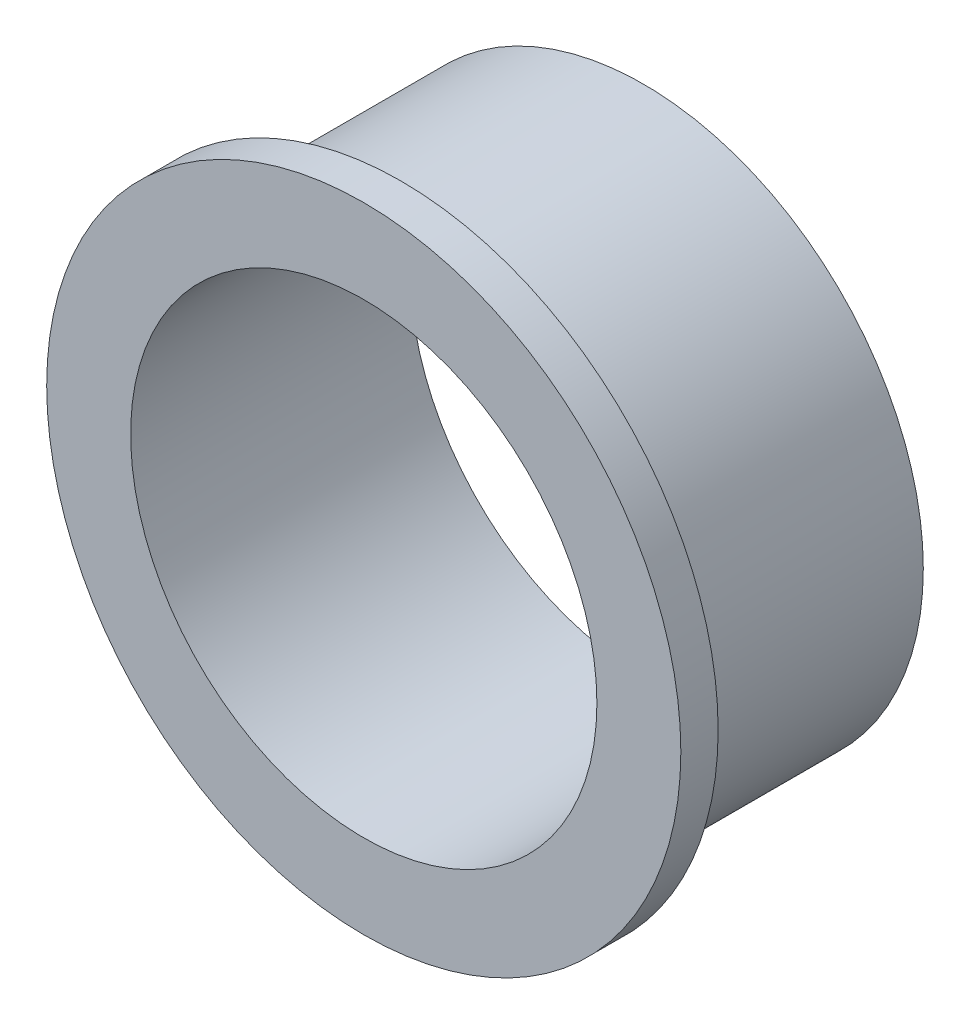
from build123d import *

# Parameters (mm, degrees)
SKETCH1_R           = 15
SKETCH1_R_2         = 12.5
BOSS_EXTRUDE1_DEPTH = 15
BOSS_EXTRUDE3_START = -2
SKETCH3_R           = 17
SKETCH3_R_2         = 15
BOSS_EXTRUDE3_DEPTH = 2


with BuildPart() as part:
    # Sketch1 → Boss-Extrude1 (new body)
    with BuildSketch(Plane.XY):
        Circle(SKETCH1_R)
        Circle(SKETCH1_R_2, mode=Mode.SUBTRACT)
    extrude(amount=BOSS_EXTRUDE1_DEPTH)

    # Sketch3 → Boss-Extrude3 (add)
    with BuildSketch(Plane.XY.offset(15).offset(BOSS_EXTRUDE3_START)):
        Circle(SKETCH3_R)
        Circle(SKETCH3_R_2, mode=Mode.SUBTRACT)
    extrude(amount=BOSS_EXTRUDE3_DEPTH)


solid = part.part
